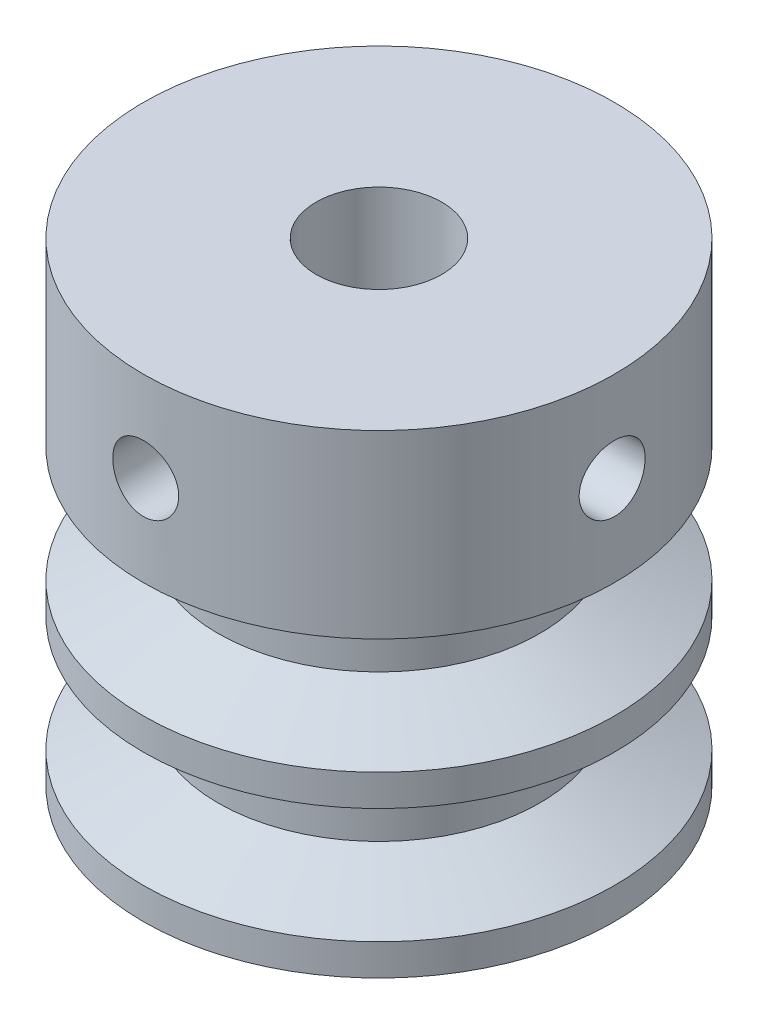
from build123d import *

# Parameters (mm, degrees)
HOLE_WIZARD_M5_2_D               = 4.2
HOLE_WIZARD_M5_2_DEPTH           = 15
HOLE_WIZARD_M5_2_ON_FACE_2_D     = 4.2
HOLE_WIZARD_M5_2_ON_FACE_2_DEPTH = 15


with BuildPart() as part:
    # 草图1 → 旋转1 (revolve)
    with BuildSketch(Plane.XY, mode=Mode.PRIVATE) as revolve_1_sk:
        Polygon((4, 30.2), (15, 30.2), (15, 18.7), (10.25, 16.525), (10.25, 13.525), (15, 11.35), (15, 9.35), (10.25, 7.175), (10.25, 4.175), (15, 2), (15, 0), (4, 0), align=None)
    revolve(revolve_1_sk.sketch.rotate(Axis((0, 48.963970588, 0), (0, -1, 0)), 90), axis=Axis((0, 48.963970588, 0), (0, -1, 0)))

    # M5 螺纹孔2
    with Locations(Plane(origin=(15, 24.45, 0), x_dir=(0, 0, 1), z_dir=(1, 0, 0))):
        with Locations((0, 0)):
            Hole(HOLE_WIZARD_M5_2_D / 2, depth=HOLE_WIZARD_M5_2_DEPTH)

    # M5 螺纹孔2 on face 2
    with Locations(Plane(origin=(0, 24.45, 15), x_dir=(1, 0, 0), z_dir=(0, 0, 1))):
        with Locations((0, 0)):
            Hole(HOLE_WIZARD_M5_2_ON_FACE_2_D / 2, depth=HOLE_WIZARD_M5_2_ON_FACE_2_DEPTH)


solid = part.part
